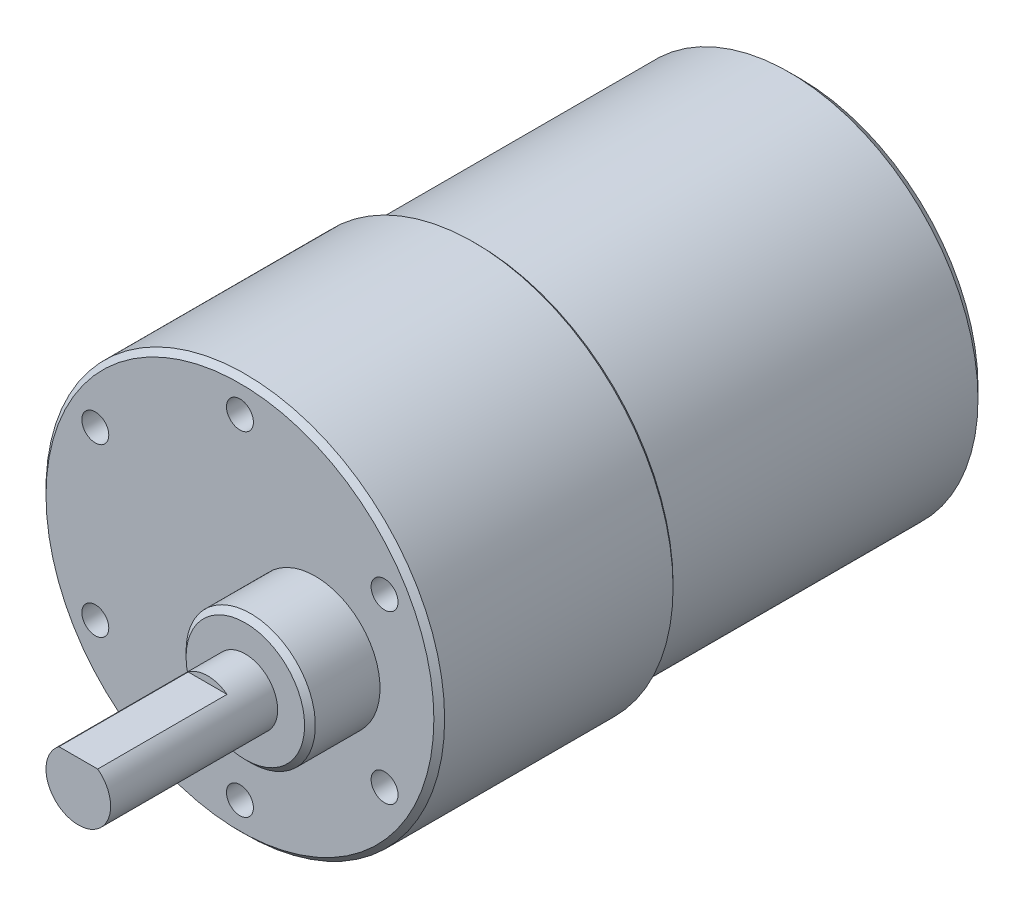
from build123d import *

# Parameters (mm, degrees)
SKETCH2_R                 = 17.5
BOSS_EXTRUDE1_DEPTH       = 30
SKETCH3_R                 = 18.5
BOSS_EXTRUDE2_DEPTH       = 22
M3X0_5_TAPPED_HOLE1_D     = 2.5
M3X0_5_TAPPED_HOLE1_DEPTH = 7.5
M3X0_5_TAPPED_HOLE1_TIP   = 0.751075774
SKETCH6_R                 = 6
BOSS_EXTRUDE3_DEPTH       = 6.5
SKETCH8_R                 = 3
BOSS_EXTRUDE4_DEPTH       = 3.5
BOSS_EXTRUDE5_DEPTH       = 12
CHAMFER1_SIZE             = 0.5
CHAMFER2_SIZE             = 0.5
CHAMFER3_SIZE             = 0.3
CHAMFER4_SIZE             = 1


with BuildPart() as part:
    # Sketch2 → Boss-Extrude1 (new body)
    with BuildSketch(Plane.XY):
        Circle(SKETCH2_R)
    extrude(amount=BOSS_EXTRUDE1_DEPTH)

    # Sketch3 → Boss-Extrude2 (add)
    with BuildSketch(Plane.XY.offset(30)):
        Circle(SKETCH3_R)
    extrude(amount=BOSS_EXTRUDE2_DEPTH)

    # M3x0.5 Tapped Hole1
    with Locations(Plane.XY.offset(52)):
        with Locations((13.423393759, -7.75), (13.423393759, 7.75), (0, 15.5), (-13.423393759, 7.75), (-13.423393759, -7.75), (0, -15.5)):
            Hole(M3X0_5_TAPPED_HOLE1_D / 2, depth=M3X0_5_TAPPED_HOLE1_DEPTH)
            with Locations((0, 0, -(M3X0_5_TAPPED_HOLE1_DEPTH + M3X0_5_TAPPED_HOLE1_TIP / 2))):  # 118° drill point
                Cone(0, M3X0_5_TAPPED_HOLE1_D / 2, M3X0_5_TAPPED_HOLE1_TIP, mode=Mode.SUBTRACT)

    # Sketch6 → Boss-Extrude3 (add)
    with BuildSketch(Plane.XY.offset(52)):
        with Locations((7, 0)):
            Circle(SKETCH6_R)
    extrude(amount=BOSS_EXTRUDE3_DEPTH)

    # Sketch8 → Boss-Extrude4 (add)
    with BuildSketch(Plane.XY.offset(58.5)):
        with Locations((7, 0)):
            Circle(SKETCH8_R)
    extrude(amount=BOSS_EXTRUDE4_DEPTH)

    # Sketch9 → Boss-Extrude5 (add)
    with BuildSketch(Plane.XY.offset(62)):
        with BuildLine():
            Line((8.8, 2.4), (5.2, 2.4))
            ThreePointArc((5.2, 2.4), (5.658359214, -2.683281573), (10, 0))
            ThreePointArc((10, 0), (9.683281573, 1.341640786), (8.8, 2.4))
        make_face()
    extrude(amount=BOSS_EXTRUDE5_DEPTH)

    # Chamfer1
    chamfer1_edges = [part.edges().sort_by_distance(p)[0] for p in [
        (-18.5, 0, 52),
    ]]
    chamfer(chamfer1_edges, length=CHAMFER1_SIZE)

    # Chamfer2
    chamfer2_edges = [part.edges().sort_by_distance(p)[0] for p in [
        (1, 0, 58.5),
    ]]
    chamfer(chamfer2_edges, length=CHAMFER2_SIZE)

    # Chamfer3
    chamfer3_edges = [part.edges().sort_by_distance(p)[0] for p in [
        (-18.5, 0, 30),
    ]]
    chamfer(chamfer3_edges, length=CHAMFER3_SIZE)

    # Chamfer4
    chamfer4_edges = [part.edges().sort_by_distance(p)[0] for p in [
        (-17.5, 0, 0),
    ]]
    chamfer(chamfer4_edges, length=CHAMFER4_SIZE)


solid = part.part
